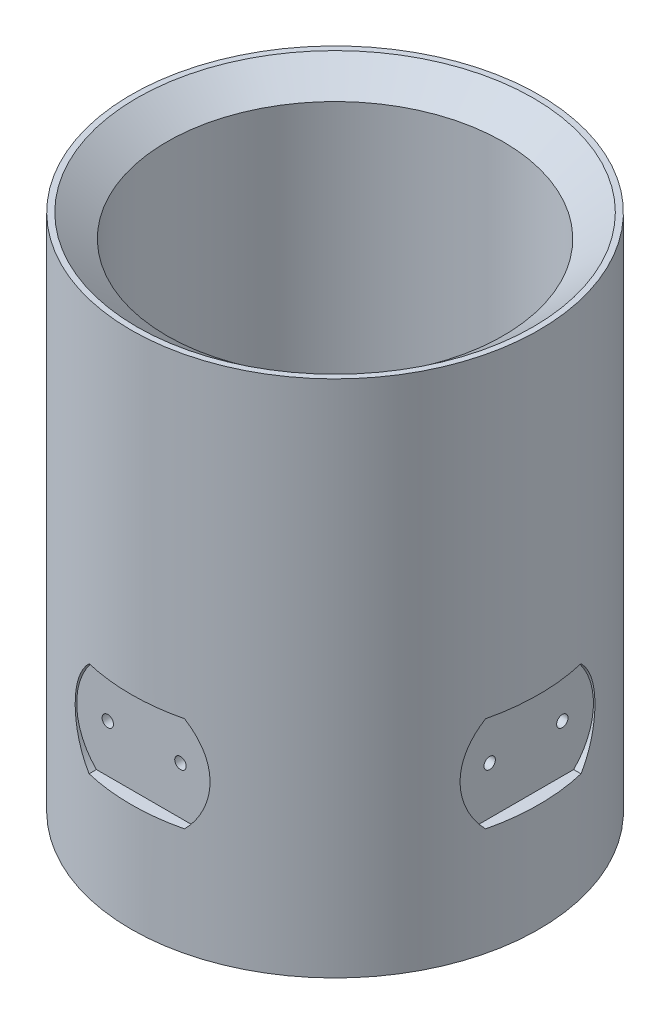
from build123d import *

# Parameters (mm, degrees)
SKETCH2_R           = 39.3
SKETCH2_R_2         = 32.4
BOSS_EXTRUDE1_DEPTH = 100
CUT_EXTRUDE1_START  = 39.3
CUT_EXTRUDE1_DEPTH  = 2.5
SKETCH4_R           = 1.1
CUT_EXTRUDE2_DEPTH  = 3
CIRPATTERN1_COUNT   = 4
CHAMFER1_SIZE       = 5.8
CHAMFER1_SIZE2      = 4.4


with BuildPart() as part:
    # Sketch2 → Boss-Extrude1 (new body)
    with BuildSketch(Plane(origin=(0, 0, 0), x_dir=(1, 0, 0), z_dir=(0, 1, 0))):
        Circle(SKETCH2_R)
        Circle(SKETCH2_R_2, mode=Mode.SUBTRACT)
    extrude(amount=BOSS_EXTRUDE1_DEPTH)

    # Sketch3 → Cut-Extrude1 (cut)
    with BuildSketch(Plane.XY.offset(CUT_EXTRUDE1_START)):
        with BuildLine():
            Line((9.192388155, 39.192388155), (-9.192388155, 39.192388155))
            ThreePointArc((-9.192388155, 39.192388155), (-13, 30), (-9.192388155, 20.807611845))
            Line((-9.192388155, 20.807611845), (9.192388155, 20.807611845))
            ThreePointArc((9.192388155, 20.807611845), (13, 30), (9.192388155, 39.192388155))
        make_face()
    cut_extrude1 = extrude(amount=-CUT_EXTRUDE1_DEPTH, mode=Mode.SUBTRACT)

    # Sketch4 → Cut-Extrude2 (cut)
    with BuildSketch(Plane.XY.offset(36.8)):
        with Locations((7, 30)):
            Circle(SKETCH4_R)
        with Locations((-7, 30)):
            Circle(SKETCH4_R)
    cut_extrude2 = extrude(amount=-CUT_EXTRUDE2_DEPTH, mode=Mode.SUBTRACT)

    # CirPattern1: Cut-Extrude1, Cut-Extrude2 ×4 about axis
    cirpattern1_axis = Axis((0, 100, 0), (0, -1, 0))
    add([cut_extrude1.rotate(cirpattern1_axis, i * 360 / CIRPATTERN1_COUNT) for i in range(1, CIRPATTERN1_COUNT)], mode=Mode.SUBTRACT)
    add([cut_extrude2.rotate(cirpattern1_axis, i * 360 / CIRPATTERN1_COUNT) for i in range(1, CIRPATTERN1_COUNT)], mode=Mode.SUBTRACT)

    # Chamfer1
    chamfer1_edges = [part.edges().sort_by_distance(p)[0] for p in [
        (-32.4, 100, 0),
    ]]
    chamfer1_side = [part.faces().sort_by_distance(p)[0] for p in [
        (-38.18842814, 100, 0),
    ]]
    chamfer(chamfer1_edges, length=CHAMFER1_SIZE, length2=CHAMFER1_SIZE2, reference=chamfer1_side[0])


solid = part.part
